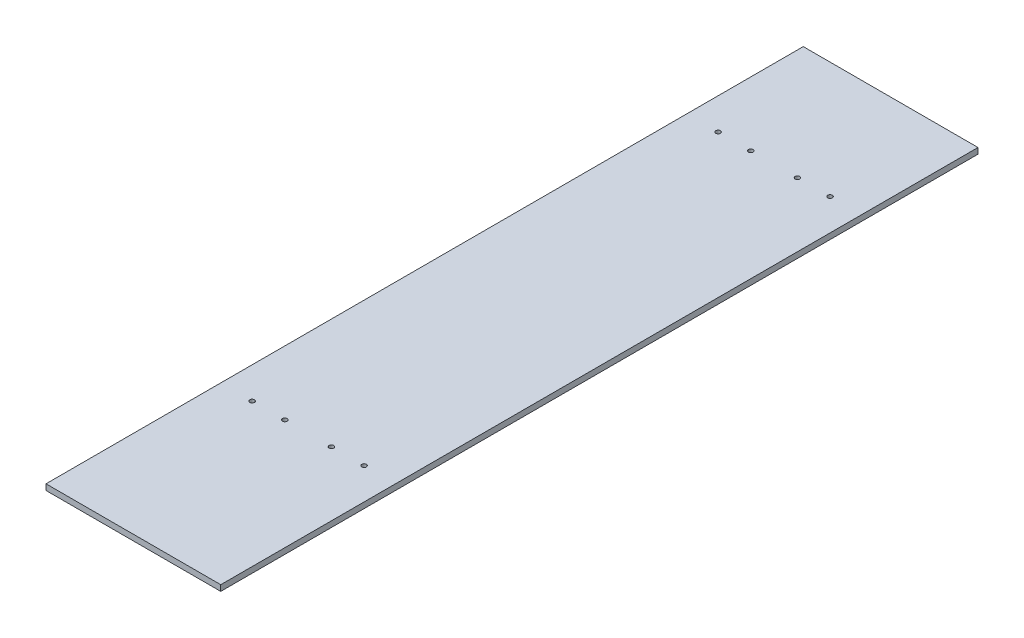
from build123d import *

# Parameters (mm, degrees)
SKETCH1_W           = 150
SKETCH1_H           = 5
BOSS_EXTRUDE1_DEPTH = 650
CUT_EXTRUDE1_REACH  = 656.332
SKETCH2_R           = 2


with BuildPart() as part:
    # Sketch1 → Boss-Extrude1 (new body)
    with BuildSketch(Plane.XY):
        Rectangle(SKETCH1_W, SKETCH1_H)
    extrude(amount=BOSS_EXTRUDE1_DEPTH)

    # Sketch2 → Cut-Extrude1 (cut, up to next)
    with BuildSketch(Plane(origin=(0, 2.5, 0), x_dir=(1, 0, 0), z_dir=(0, 1, 0)), mode=Mode.PRIVATE) as cut_extrude1_sk1:
        with Locations(Location((-20, -500, 0), (0, 0, 180))):
            Circle(SKETCH2_R)
    cut_extrude1_tool1 = extrude(cut_extrude1_sk1.sketch, amount=-CUT_EXTRUDE1_REACH, mode=Mode.PRIVATE) & part.part
    # Sketch2 → Cut-Extrude1 (cut, up to next)
    with BuildSketch(Plane(origin=(0, 2.5, 0), x_dir=(1, 0, 0), z_dir=(0, 1, 0)), mode=Mode.PRIVATE) as cut_extrude1_sk2:
        with Locations(Location((-48, -500, 0), (0, 0, 180))):
            Circle(SKETCH2_R)
    cut_extrude1_tool2 = extrude(cut_extrude1_sk2.sketch, amount=-CUT_EXTRUDE1_REACH, mode=Mode.PRIVATE) & part.part
    # Sketch2 → Cut-Extrude1 (cut, up to next)
    with BuildSketch(Plane(origin=(0, 2.5, 0), x_dir=(1, 0, 0), z_dir=(0, 1, 0)), mode=Mode.PRIVATE) as cut_extrude1_sk3:
        with Locations(Location((48, -500, 0), (0, 0, 180))):
            Circle(SKETCH2_R)
    cut_extrude1_tool3 = extrude(cut_extrude1_sk3.sketch, amount=-CUT_EXTRUDE1_REACH, mode=Mode.PRIVATE) & part.part
    # Sketch2 → Cut-Extrude1 (cut, up to next)
    with BuildSketch(Plane(origin=(0, 2.5, 0), x_dir=(1, 0, 0), z_dir=(0, 1, 0)), mode=Mode.PRIVATE) as cut_extrude1_sk4:
        with Locations(Location((20, -500, 0), (0, 0, 180))):
            Circle(SKETCH2_R)
    cut_extrude1_tool4 = extrude(cut_extrude1_sk4.sketch, amount=-CUT_EXTRUDE1_REACH, mode=Mode.PRIVATE) & part.part
    # Sketch2 → Cut-Extrude1 (cut, up to next)
    with BuildSketch(Plane(origin=(0, 2.5, 0), x_dir=(1, 0, 0), z_dir=(0, 1, 0)), mode=Mode.PRIVATE) as cut_extrude1_sk5:
        with Locations(Location((48, -100, 0), (0, 0, 180))):
            Circle(SKETCH2_R)
    cut_extrude1_tool5 = extrude(cut_extrude1_sk5.sketch, amount=-CUT_EXTRUDE1_REACH, mode=Mode.PRIVATE) & part.part
    # Sketch2 → Cut-Extrude1 (cut, up to next)
    with BuildSketch(Plane(origin=(0, 2.5, 0), x_dir=(1, 0, 0), z_dir=(0, 1, 0)), mode=Mode.PRIVATE) as cut_extrude1_sk6:
        with Locations(Location((20, -100, 0), (0, 0, 180))):
            Circle(SKETCH2_R)
    cut_extrude1_tool6 = extrude(cut_extrude1_sk6.sketch, amount=-CUT_EXTRUDE1_REACH, mode=Mode.PRIVATE) & part.part
    # Sketch2 → Cut-Extrude1 (cut, up to next)
    with BuildSketch(Plane(origin=(0, 2.5, 0), x_dir=(1, 0, 0), z_dir=(0, 1, 0)), mode=Mode.PRIVATE) as cut_extrude1_sk7:
        with Locations(Location((-20, -100, 0), (0, 0, 180))):
            Circle(SKETCH2_R)
    cut_extrude1_tool7 = extrude(cut_extrude1_sk7.sketch, amount=-CUT_EXTRUDE1_REACH, mode=Mode.PRIVATE) & part.part
    # Sketch2 → Cut-Extrude1 (cut, up to next)
    with BuildSketch(Plane(origin=(0, 2.5, 0), x_dir=(1, 0, 0), z_dir=(0, 1, 0)), mode=Mode.PRIVATE) as cut_extrude1_sk8:
        with Locations(Location((-48, -100, 0), (0, 0, 180))):
            Circle(SKETCH2_R)
    cut_extrude1_tool8 = extrude(cut_extrude1_sk8.sketch, amount=-CUT_EXTRUDE1_REACH, mode=Mode.PRIVATE) & part.part
    add(cut_extrude1_tool1.solids().sort_by_distance((-20, 2.5, 500))[0], mode=Mode.SUBTRACT)
    add(cut_extrude1_tool2.solids().sort_by_distance((-48, 2.5, 500))[0], mode=Mode.SUBTRACT)
    add(cut_extrude1_tool3.solids().sort_by_distance((48, 2.5, 500))[0], mode=Mode.SUBTRACT)
    add(cut_extrude1_tool4.solids().sort_by_distance((20, 2.5, 500))[0], mode=Mode.SUBTRACT)
    add(cut_extrude1_tool5.solids().sort_by_distance((48, 2.5, 100))[0], mode=Mode.SUBTRACT)
    add(cut_extrude1_tool6.solids().sort_by_distance((20, 2.5, 100))[0], mode=Mode.SUBTRACT)
    add(cut_extrude1_tool7.solids().sort_by_distance((-20, 2.5, 100))[0], mode=Mode.SUBTRACT)
    add(cut_extrude1_tool8.solids().sort_by_distance((-48, 2.5, 100))[0], mode=Mode.SUBTRACT)


solid = part.part
